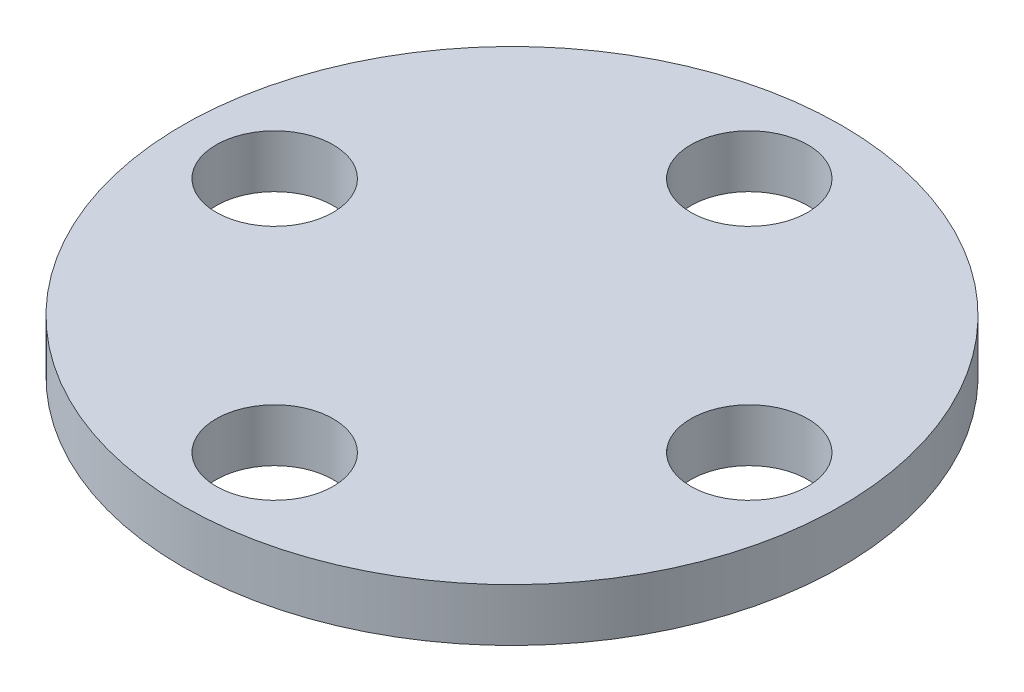
from build123d import *

# Parameters (mm, degrees)
SKETCH1_R           = 15.875
BOSS_EXTRUDE1_DEPTH = 2.54
SKETCH2_R           = 2.8194
CUT_EXTRUDE1_DEPTH  = 2.54


with BuildPart() as part:
    # Sketch1 → Boss-Extrude1 (new body)
    with BuildSketch(Plane(origin=(0, 0, 0), x_dir=(1, 0, 0), z_dir=(0, 1, 0))):
        with Locations(Location((0, 0, 0), (0, 0, 270))):
            Circle(SKETCH1_R)
    extrude(amount=BOSS_EXTRUDE1_DEPTH)

    # Sketch2 → Cut-Extrude1 (cut)
    with BuildSketch(Plane(origin=(0, 2.54, 0), x_dir=(1, 0, 0), z_dir=(0, 1, 0))):
        with Locations(Location((0, 11.43, 0), (0, 0, 270))):
            Circle(SKETCH2_R)
        with Locations(Location((11.43, 0, 0), (0, 0, 270))):
            Circle(SKETCH2_R)
        with Locations(Location((0, -11.43, 0), (0, 0, 270))):
            Circle(SKETCH2_R)
        with Locations(Location((-11.43, 0, 0), (0, 0, 270))):
            Circle(SKETCH2_R)
    extrude(amount=-CUT_EXTRUDE1_DEPTH, mode=Mode.SUBTRACT)


solid = part.part
